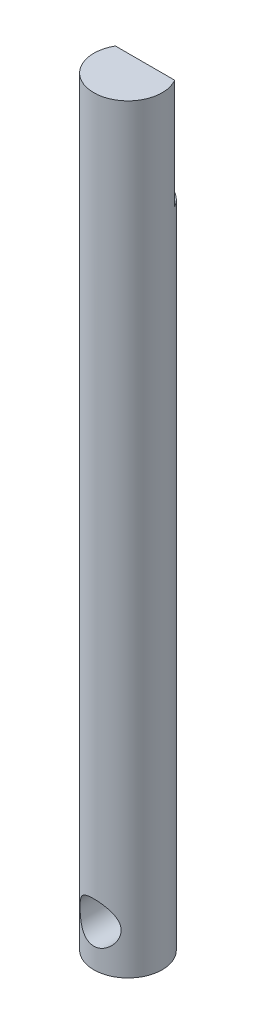
from build123d import *

# Parameters (mm, degrees)
SKETCH1_R               = 3.96875
BOSS_EXTRUDE1_DEPTH     = 88.138
CUT_EXTRUDE1_DEPTH      = 12.7
CUT_EXTRUDE2_DEPTH      = 12.7
CUT_EXTRUDE2_DEPTH_BACK = 12.7
SKETCH3_R               = 2.38125


with BuildPart() as part:
    # Sketch1 → Boss-Extrude1 (new body)
    with BuildSketch(Plane(origin=(0, 0, 0), x_dir=(1, 0, 0), z_dir=(0, 1, 0))):
        Circle(SKETCH1_R)
    extrude(amount=BOSS_EXTRUDE1_DEPTH)

    # Sketch2 → Cut-Extrude1 (cut)
    with BuildSketch(Plane(origin=(0, 88.138, 0), x_dir=(1, 0, 0), z_dir=(0, 1, 0))):
        Polygon((3.437038321, 1.984375), (-3.437038321, 1.984375), (-4.719395918, 2.522465653), (-2.590204502, 6.353236507), (2.456720437, 4.728926773), align=None)
    extrude(amount=-CUT_EXTRUDE1_DEPTH, mode=Mode.SUBTRACT)

    # Sketch3 → Cut-Extrude2 (cut, two sides: drawn at the far end of the back side and taken through both)
    with BuildSketch(Plane(origin=(0, 0, -1.984375), x_dir=(-1, 0, 0), z_dir=(0, 0, -1)).offset(-CUT_EXTRUDE2_DEPTH_BACK)):
        with Locations((0, 4.7625)):
            Circle(SKETCH3_R)
    extrude(amount=CUT_EXTRUDE2_DEPTH + CUT_EXTRUDE2_DEPTH_BACK, mode=Mode.SUBTRACT)


solid = part.part
